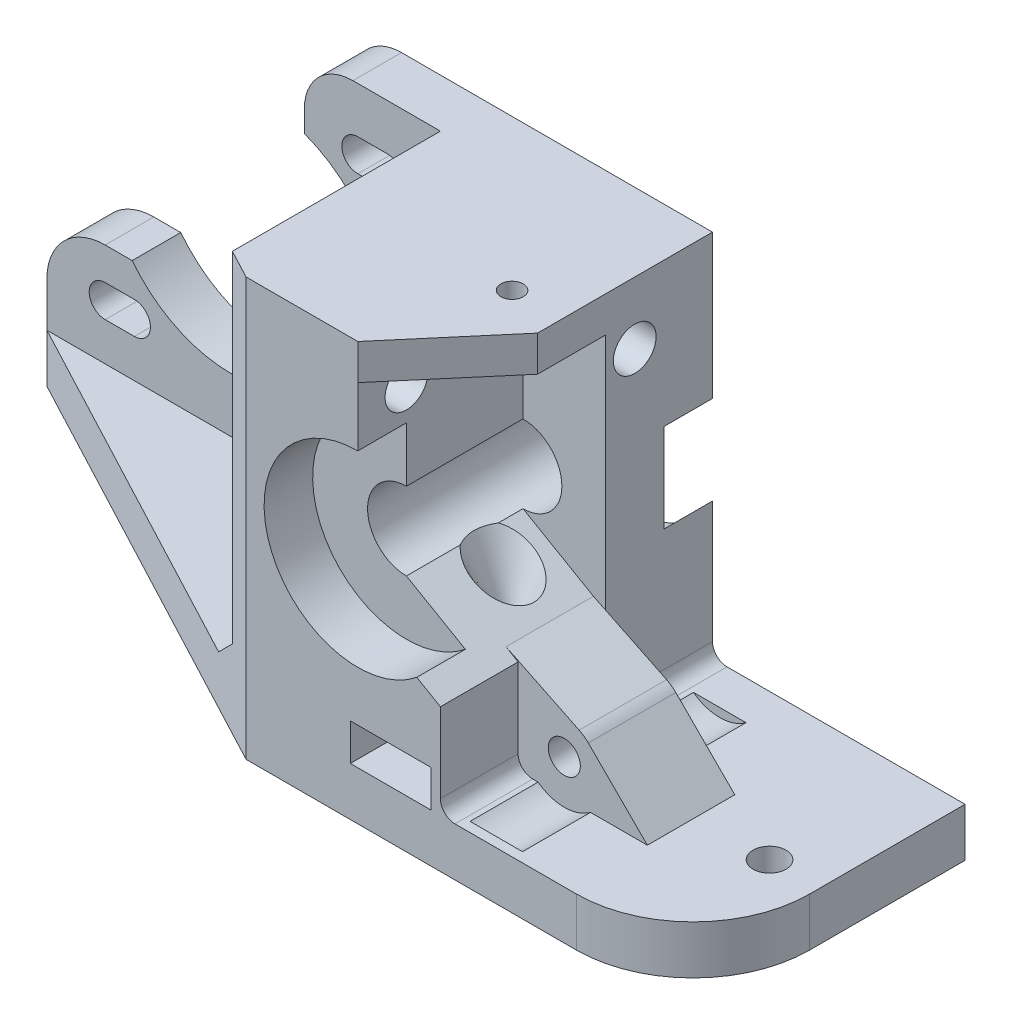
from build123d import *

# Parameters (mm, degrees)
SKETCH1_R                = 4
BOSS_EXTRUDE1_DEPTH      = 28
SKETCH2_W                = 40.5
SKETCH2_H                = 38
CUT_EXTRUDE1_DEPTH       = 23
SKETCH3_R                = 9.65
CUT_EXTRUDE2_DEPTH       = 5
CUT_EXTRUDE3_START       = -5
SKETCH4_R                = 9.65
CUT_EXTRUDE3_DEPTH       = 5
SKETCH8_R                = 1.15
CUT_EXTRUDE7_DEPTH       = 76.219678276
CHAMFER1_SIZE            = 23
CHAMFER1_SIZE2           = 43.5
SKETCH9_R                = 2.2
CUT_EXTRUDE8_DEPTH       = 97.701654612
CUT_EXTRUDE9_DEPTH       = 3
CUT_EXTRUDE9_DEPTH_BACK  = 4
CHAMFER2_SIZE            = 3
SKETCH15_R               = 1.7
CUT_EXTRUDE11_DEPTH      = 76.219678334
SKETCH16_W               = 26
SKETCH16_H               = 38
CUT_EXTRUDE12_DEPTH      = 67.075411499
FILLET6_R                = 1.5
CUT_EXTRUDE13_START      = -17
CUT_EXTRUDE13_DEPTH      = 17
BOSS_EXTRUDE3_DEPTH      = 4.5
BOSS_EXTRUDE3_DEPTH_BACK = 4.5
SKETCH21_R               = 1.65
SKETCH22_R               = 4.5
CUT_EXTRUDE14_DEPTH      = 7
CHAMFER4_SIZE            = 8.5
CHAMFER4_SIZE2           = 10
FILLET1_R                = 5
FILLET2_R                = 6
FILLET4_R                = 12
CUT_EXTRUDE15_DEPTH      = 3.8
CUT_EXTRUDE18_REACH      = 77.22
SKETCH26_R               = 3.15


with BuildPart() as part:
    # Sketch1 → Boss-Extrude1 (new body)
    with BuildSketch(Plane.XY):
        with BuildLine():
            Line((-55, -23.6), (34.5, -23.6))
            Line((34.5, -23.6), (34.5, 19.4))
            Line((34.5, 19.4), (-28.5, 19.4))
            Line((-28.5, 19.4), (-28.5, 12.180409823))
            ThreePointArc((-28.5, 12.180409823), (-20.217668105, -2.285689125), (-33, -12.985083113))
            Line((-33, -12.985083113), (-36, -12.985083113))
            ThreePointArc((-36, -12.985083113), (-41.689100041, -11.672468641), (-46.228019527, -8))
            Line((-46.228019527, -8), (-55, -8))
            Line((-55, -8), (-55, -23.6))
        make_face()
        Circle(SKETCH1_R, mode=Mode.SUBTRACT)
        with BuildLine():
            Line((-23, 11.35), (-20, 11.35))
            ThreePointArc((-20, 11.35), (-18.35, 13), (-20, 14.65))
            Line((-20, 14.65), (-23, 14.65))
            ThreePointArc((-23, 14.65), (-24.65, 13), (-23, 11.35))
        make_face(mode=Mode.SUBTRACT)
        with BuildLine():
            Line((-23, -14.65), (-20, -14.65))
            ThreePointArc((-20, -14.65), (-18.35, -13), (-20, -11.35))
            Line((-20, -11.35), (-23, -11.35))
            ThreePointArc((-23, -11.35), (-24.65, -13), (-23, -14.65))
        make_face(mode=Mode.SUBTRACT)
        with BuildLine():
            Line((-46, -11.35), (-49, -11.35))
            ThreePointArc((-49, -11.35), (-50.65, -13), (-49, -14.65))
            Line((-49, -14.65), (-46, -14.65))
            ThreePointArc((-46, -14.65), (-44.35, -13), (-46, -11.35))
        make_face(mode=Mode.SUBTRACT)
    extrude(amount=BOSS_EXTRUDE1_DEPTH)

    # Sketch2 → Cut-Extrude1 (cut)
    with BuildSketch(Plane.XY.offset(28)):
        with Locations((-34.75, 0.4)):
            Rectangle(SKETCH2_W, SKETCH2_H)
    extrude(amount=-CUT_EXTRUDE1_DEPTH, mode=Mode.SUBTRACT)

    # Sketch3 → Cut-Extrude2 (cut)
    with BuildSketch(Plane.XY.offset(28)):
        Circle(SKETCH3_R)
    extrude(amount=-CUT_EXTRUDE2_DEPTH, mode=Mode.SUBTRACT)

    # Sketch4 → Cut-Extrude3 (cut)
    with BuildSketch(Plane(origin=(0, 0, 0), x_dir=(-1, 0, 0), z_dir=(0, 0, -1)).offset(CUT_EXTRUDE3_START)):
        with Locations(Location((0, 0, 0), (0, 0, 180))):
            Circle(SKETCH4_R)
    extrude(amount=CUT_EXTRUDE3_DEPTH, mode=Mode.SUBTRACT)

    # Sketch8 → Cut-Extrude7 (cut, through all)
    with BuildSketch(Plane.XZ.offset(23.6)):
        with Locations(Location((3.375, 15.5, 0), (0, 0, 270))):
            Circle(SKETCH8_R)
    extrude(amount=-CUT_EXTRUDE7_DEPTH, mode=Mode.SUBTRACT)

    # Chamfer1
    chamfer1_edges = [part.edges().sort_by_distance(p)[0] for p in [
        (-55, -21.1, 28),
    ]]
    chamfer1_side = [part.faces().sort_by_distance(p)[0] for p in [
        (-55, -18.958031088, 10.841968912),
    ]]
    chamfer(chamfer1_edges, length=CHAMFER1_SIZE, length2=CHAMFER1_SIZE2, reference=chamfer1_side[0])

    # Sketch9 → Cut-Extrude8 (cut, through all)
    with BuildSketch(Plane(origin=(34.5, 0, 0), x_dir=(0, 0, -1), z_dir=(1, 0, 0))):
        with Locations((-8, 13)):
            Circle(SKETCH9_R)
        with Locations((-23, 13)):
            Circle(SKETCH9_R)
    extrude(amount=-CUT_EXTRUDE8_DEPTH, mode=Mode.SUBTRACT)

    # Sketch10 → Cut-Extrude9 (cut, two sides: drawn at the far end of the back side and taken through both)
    with BuildSketch(Plane.ZY.offset(14.5).offset(-CUT_EXTRUDE9_DEPTH_BACK)):
        Polygon((5.1, 14.674315781), (5.1, 11.325684219), (8, 9.651368439), (10.9, 11.325684219), (10.9, 14.674315781), (8, 16.348631561), align=None)
        Polygon((25.9, 11.325684219), (25.9, 14.674315781), (23, 16.348631561), (20.1, 14.674315781), (20.1, 11.325684219), (23, 9.651368439), align=None)
    extrude(amount=CUT_EXTRUDE9_DEPTH + CUT_EXTRUDE9_DEPTH_BACK, mode=Mode.SUBTRACT)

    # Chamfer2
    chamfer2_edges = [part.edges().sort_by_distance(p)[0] for p in [
        (-14.5, -18.6, 15.706896552),
    ]]
    chamfer(chamfer2_edges, length=CHAMFER2_SIZE)

    # Sketch15 → Cut-Extrude11 (cut, through all)
    with BuildSketch(Plane.XZ.offset(23.6)):
        with Locations(Location((-20.625, 15, 0), (0, 0, 270))):
            Circle(SKETCH15_R)
        with Locations(Location((29.375, 15, 0), (0, 0, 270))):
            Circle(SKETCH15_R)
    extrude(amount=-CUT_EXTRUDE11_DEPTH, mode=Mode.SUBTRACT)

    # Sketch16 → Cut-Extrude12 (cut, through all)
    with BuildSketch(Plane.XY.offset(28)):
        with Locations((21.5, 0.4)):
            Rectangle(SKETCH16_W, SKETCH16_H)
    extrude(amount=-CUT_EXTRUDE12_DEPTH, mode=Mode.SUBTRACT)

    # Fillet6
    fillet6_edges = [part.edges().sort_by_distance(p)[0] for p in [
        (8.5, -18.6, 14),
    ]]
    fillet(fillet6_edges, radius=FILLET6_R)

    # Sketch17 → Cut-Extrude13 (cut)
    with BuildSketch(Plane.XY.offset(28).offset(CUT_EXTRUDE13_START)):
        with BuildLine():
            Line((0, 4), (0, 15.733500455))
            Line((0, 15.733500455), (8.5, 15.733500455))
            Line((8.5, 15.733500455), (8.5, -8.907477288))
            Line((8.5, -8.907477288), (0, -4))
            ThreePointArc((0, -4), (4, 0), (0, 4))
        make_face()
    extrude(amount=CUT_EXTRUDE13_DEPTH, mode=Mode.SUBTRACT)

    # Sketch20 → Cut-Revolve1 (revolve, cut)
    with BuildSketch(Plane.XY.offset(15.5), mode=Mode.PRIVATE) as cut_revolve1_sk:
        Polygon((3.375, -11.8), (7.375, -3.8), (3.375, -3.8), align=None)
    revolve(cut_revolve1_sk.sketch.rotate(Axis((3.375, -3.8, 15.5), (0, -1, 0)), 270), axis=Axis((3.375, -3.8, 15.5), (0, -1, 0)), mode=Mode.SUBTRACT)

    # Sketch21 → Boss-Extrude3 (add, two sides: drawn at the far end of the back side and taken through both)
    with BuildSketch(Plane.XY.offset(15.5).offset(-BOSS_EXTRUDE3_DEPTH_BACK)):
        with BuildLine():
            Line((14.782175503, -11.85318602), (7.25, -8.185789452))
            Line((7.25, -8.185789452), (7.25, -18.6))
            Line((7.25, -18.6), (21.799747468, -18.6))
            Line((21.799747468, -18.6), (15.724873734, -12.525126266))
            ThreePointArc((15.724873734, -12.525126266), (15.281498664, -12.14990997), (14.782175503, -11.85318602))
        make_face()
        with Locations((13.25, -15)):
            Circle(SKETCH21_R, mode=Mode.SUBTRACT)
    extrude(amount=BOSS_EXTRUDE3_DEPTH + BOSS_EXTRUDE3_DEPTH_BACK)

    # Sketch22 → Cut-Extrude14 (cut)
    with BuildSketch(Plane.XY.offset(20)):
        with Locations((13.25, -15)):
            Circle(SKETCH22_R)
    cut_extrude14 = extrude(amount=CUT_EXTRUDE14_DEPTH, mode=Mode.SUBTRACT)

    # Mirror1: Cut-Extrude14 across plane
    add(cut_extrude14.mirror(Plane.XY.offset(15.5)), mode=Mode.SUBTRACT)

    # Chamfer4
    chamfer4_edges = [part.edges().sort_by_distance(p)[0] for p in [
        (8.5, 17.566750228, 28),
    ]]
    chamfer4_side = [part.faces().sort_by_distance(p)[0] for p in [
        (7.87031754, -13.003738644, 28),
    ]]
    chamfer(chamfer4_edges, length=CHAMFER4_SIZE, length2=CHAMFER4_SIZE2, reference=chamfer4_side[0])

    # Fillet1
    fillet1_edges = [part.edges().sort_by_distance(p)[0] for p in [
        (-28.5, 19.4, 2.5),
    ]]
    fillet(fillet1_edges, radius=FILLET1_R)

    # Fillet2
    fillet2_edges = [part.edges().sort_by_distance(p)[0] for p in [
        (-55, -8, 2.5),
    ]]
    fillet(fillet2_edges, radius=FILLET2_R)

    # Fillet4
    fillet4_edges = [part.edges().sort_by_distance(p)[0] for p in [
        (34.5, -21.1, 28),
    ]]
    fillet(fillet4_edges, radius=FILLET4_R)

    # Sketch23 → Cut-Extrude15 (cut)
    with BuildSketch(Plane.XZ.offset(18.6)):
        Polygon((-0.775, 28.722034997), (7.525, 28.722034997), (7.525, 13.103996383), (3.375, 10.707992766), (-0.775, 13.103996383), align=None)
    extrude(amount=-CUT_EXTRUDE15_DEPTH, mode=Mode.SUBTRACT)

    # Sketch26 → Cut-Extrude18 (cut, up to next)
    with BuildSketch(Plane.XZ.offset(23.6), mode=Mode.PRIVATE) as cut_extrude18_sk1:
        with Locations(Location((3.375, 15.5, 0), (0, 0, 270))):
            Circle(SKETCH26_R)
    cut_extrude18_tool1 = extrude(cut_extrude18_sk1.sketch, amount=-CUT_EXTRUDE18_REACH, mode=Mode.PRIVATE) & part.part
    add(cut_extrude18_tool1.solids().sort_by_distance((3.375, -23.6, 15.5))[0], mode=Mode.SUBTRACT)


solid = part.part
